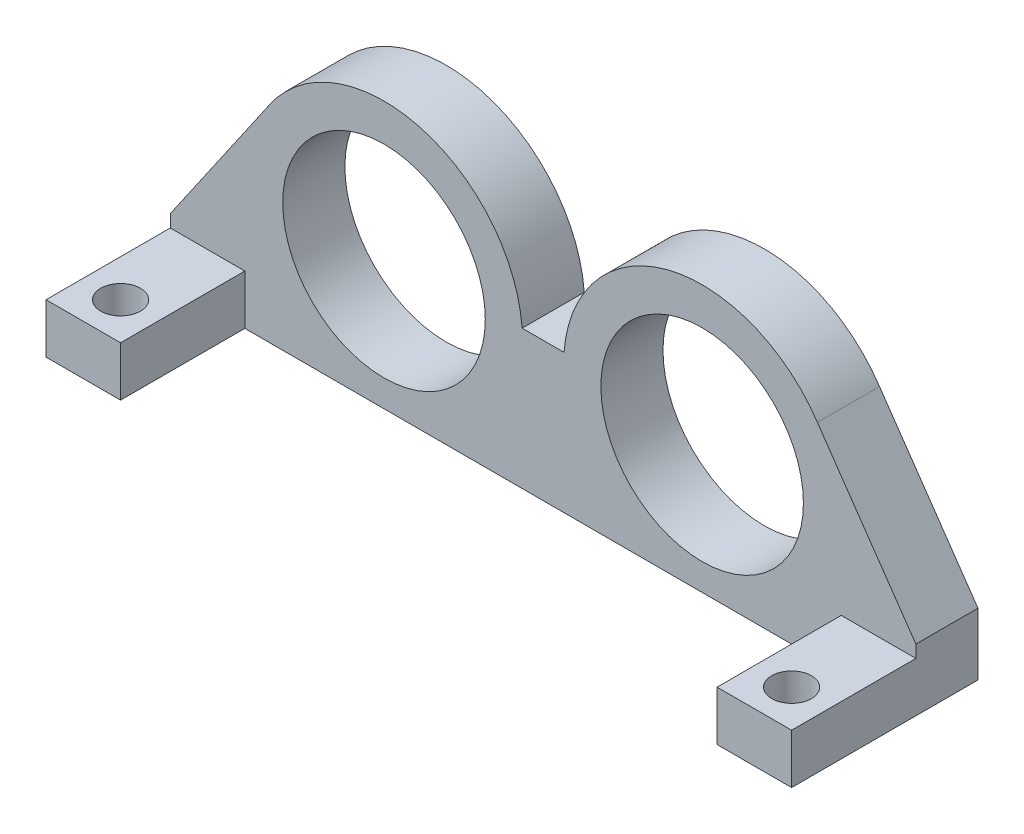
from build123d import *

# Parameters (mm, degrees)
SKETCH1_R           = 8.15
BOSS_EXTRUDE1_DEPTH = 5
SKETCH3_W           = 6
SKETCH3_H           = 4
BOSS_EXTRUDE2_DEPTH = 10
SKETCH4_R           = 1.6
CUT_EXTRUDE1_DEPTH  = 10


with BuildPart() as part:
    # Sketch1 → Boss-Extrude1 (new body)
    with BuildSketch(Plane.XY):
        with BuildLine():
            Line((30, 0), (-30, 0))
            Line((-30, 0), (-30, 5))
            Line((-30, 5), (-22.076055104, 16.485922475))
            ThreePointArc((-22.076055104, 16.485922475), (-9.989658142, 21.089074765), (-1.684442299, 11.174772352))
            Line((-1.684442299, 11.174772352), (1.684442299, 11.174772352))
            ThreePointArc((1.684442299, 11.174772352), (9.989658142, 21.089074765), (22.076055104, 16.485922475))
            Line((22.076055104, 16.485922475), (30, 5))
            Line((30, 5), (30, 0))
        make_face()
        with Locations((-12.8, 10.299057219)):
            Circle(SKETCH1_R, mode=Mode.SUBTRACT)
        with Locations(Location((12.8, 10.299057219, 0), (0, 0, 180))):
            Circle(SKETCH1_R, mode=Mode.SUBTRACT)
    extrude(amount=BOSS_EXTRUDE1_DEPTH)

    # Sketch3 → Boss-Extrude2 (add)
    with BuildSketch(Plane.XY.offset(5)):
        with Locations((-27, 2)):
            Rectangle(SKETCH3_W, SKETCH3_H)
        with Locations((27, 2)):
            Rectangle(SKETCH3_W, SKETCH3_H)
    extrude(amount=BOSS_EXTRUDE2_DEPTH)

    # Sketch4 → Cut-Extrude1 (cut)
    with BuildSketch(Plane(origin=(0, 4, 0), x_dir=(1, 0, 0), z_dir=(0, 1, 0))):
        with Locations(Location((-27, -12, 0), (0, 0, 270))):
            Circle(SKETCH4_R)
        with Locations(Location((27, -12, 0), (0, 0, 270))):
            Circle(SKETCH4_R)
    extrude(amount=-CUT_EXTRUDE1_DEPTH, mode=Mode.SUBTRACT)


solid = part.part
